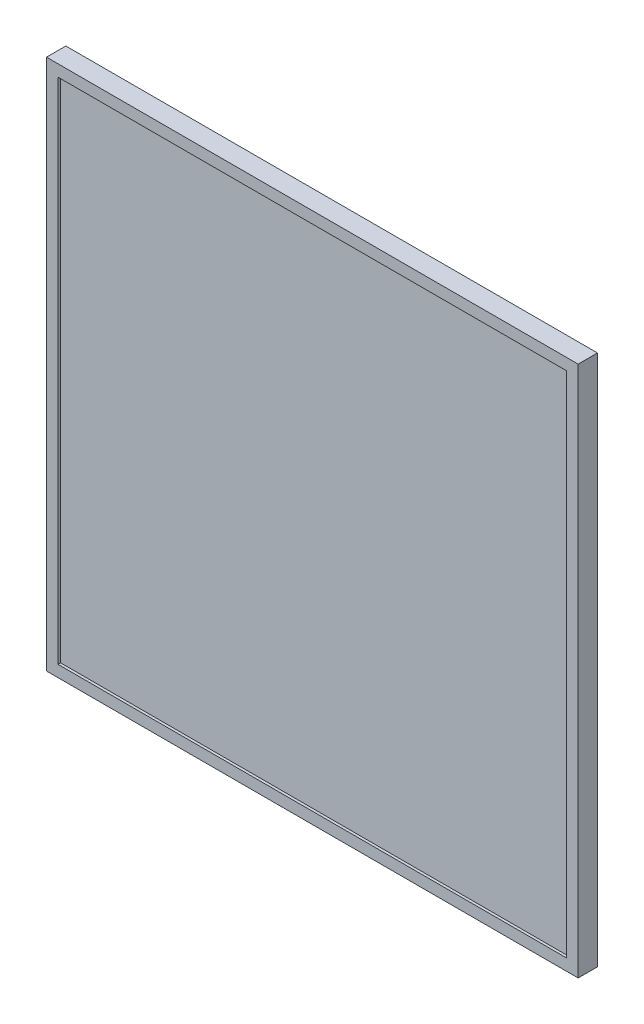
from build123d import *

# Parameters (mm, degrees)
SKIZZE1_W                       = 412.5
SKIZZE1_H                       = 412.5
AUFSATZ_LINEAR_AUSTRAGEN1_DEPTH = 15
SKIZZE2_W                       = 394.56
SKIZZE2_H                       = 394.56
SCHNITT_LINEAR_AUSTRAGEN1_DEPTH = 2
AUFSATZ_LINEAR_START            = -256.25
AUFSATZ_LINEAR_AUSTRAGEN2_DEPTH = 100


with BuildPart() as part:
    # Skizze1 → Aufsatz-Linear austragen1 (new body)
    with BuildSketch(Plane.XY):
        with Locations((206.25, -206.25)):
            Rectangle(SKIZZE1_W, SKIZZE1_H)
    extrude(amount=AUFSATZ_LINEAR_AUSTRAGEN1_DEPTH)

    # Skizze2 → Schnitt-Linear austragen1 (cut)
    with BuildSketch(Plane.XY.offset(15)):
        with Locations((206.25, -206.25)):
            Rectangle(SKIZZE2_W, SKIZZE2_H)
    extrude(amount=-SCHNITT_LINEAR_AUSTRAGEN1_DEPTH, mode=Mode.SUBTRACT)

    # Skizze3 → Aufsatz-Linear austragen2 (add)
    with BuildSketch(Plane(origin=(412.5, 0, 0), x_dir=(0, 0, -1), z_dir=(1, 0, 0)).offset(AUFSATZ_LINEAR_START)):
        Polygon((0, -206.25), (146.291749205, -360.735735275), (125.739095453, -368.119079257), (0, -235.337177889), align=None)
    extrude(amount=AUFSATZ_LINEAR_AUSTRAGEN2_DEPTH)


solid = part.part
